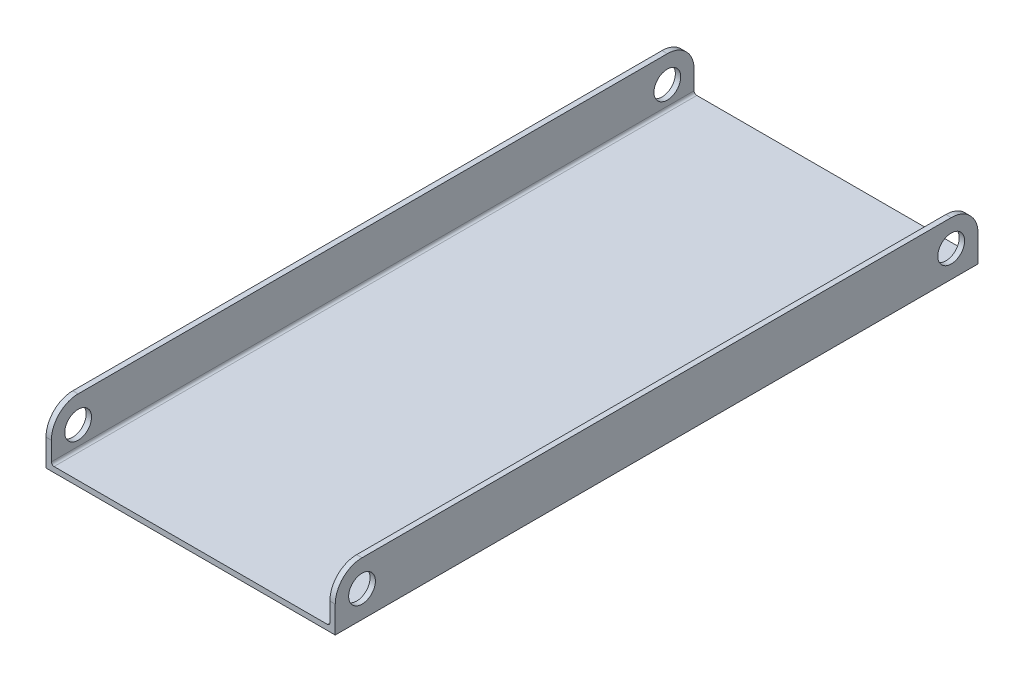
from build123d import *

# Parameters (mm, degrees)
BOSS_EXTRUDE1_DEPTH = 152.4
FILLET1_R           = 0.635
FILLET2_R           = 6.35
SKETCH3_R           = 3.175
CUT_EXTRUDE1_DEPTH  = 152.4


with BuildPart() as part:
    # Sketch1 → Boss-Extrude1 (new body)
    with BuildSketch(Plane.XY):
        Polygon((0, 0), (-68.58, 0), (-68.58, 12.7), (-67.31, 12.7), (-67.31, 1.27), (-1.27, 1.27), (-1.27, 12.7), (0, 12.7), align=None)
    extrude(amount=-BOSS_EXTRUDE1_DEPTH)

    # Fillet1
    fillet1_edges = [part.edges().sort_by_distance(p)[0] for p in [
        (-67.31, 1.27, -76.2),
        (-1.27, 1.27, -76.2),
    ]]
    fillet(fillet1_edges, radius=FILLET1_R)

    # Fillet2
    fillet2_edges = [part.edges().sort_by_distance(p)[0] for p in [
        (-0.635, 12.7, 0),
        (-67.945, 12.7, -152.4),
        (-0.635, 12.7, -152.4),
        (-67.945, 12.7, 0),
    ]]
    fillet(fillet2_edges, radius=FILLET2_R)

    # Sketch3 → Cut-Extrude1 (cut)
    with BuildSketch(Plane(origin=(0, 0, 0), x_dir=(0, 0, -1), z_dir=(1, 0, 0))):
        with Locations(Location((6.35, 6.35, 0), (0, 0, 90))):
            Circle(SKETCH3_R)
        with Locations(Location((146.05, 6.35, 0), (0, 0, 90))):
            Circle(SKETCH3_R)
    extrude(amount=-CUT_EXTRUDE1_DEPTH, mode=Mode.SUBTRACT)


solid = part.part
